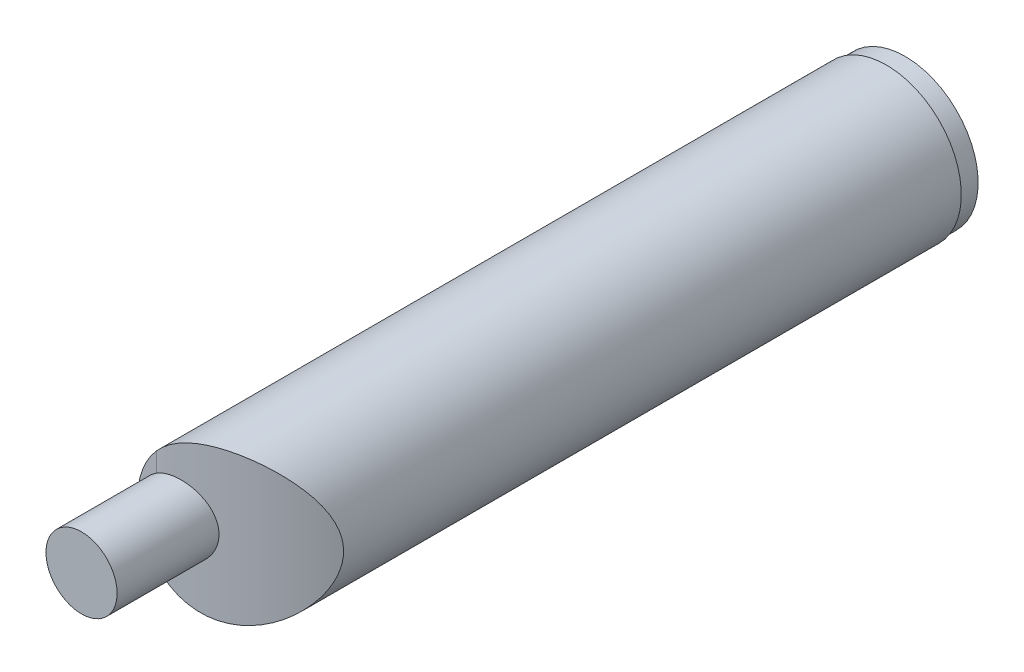
from build123d import *
from build123d.topology import SkipClean

# Parameters (mm, degrees)
SKETCH_1_R                  = 4
EXTRUDE_1_DEPTH             = 37
SKETCH_2_R                  = 4
SKETCH_2_R_2                = 3.9
SKETCH_2_R_3                = 0.5
CUT_EXTRUDE_1_DEPTH         = 1
CUT_EXTRUDE_2_DEPTH         = 38.429934544
CUT_EXTRUDE_2_DEPTH_BACK    = 38.429934544
EXTRUDE_2_REACH             = 39.43
SKETCH_4_R                  = 1.9
EXTRUDE_2_DIRECTION_2_DEPTH = 5


with BuildPart() as part:
    # 草图1 → 凸台-拉伸1 (new body)
    with BuildSketch(Plane.XY):
        Circle(SKETCH_1_R)
    extrude(amount=EXTRUDE_1_DEPTH)

    # 草图2 → 切除-拉伸1 (cut)
    # profile 1 of 2: a face of its own
    with BuildSketch(Plane(origin=(0, 0, 0), x_dir=(-1, 0, 0), z_dir=(0, 0, -1))):
        Circle(SKETCH_2_R)
        Circle(SKETCH_2_R_2, mode=Mode.SUBTRACT)
    # profile 2 of 2: a face of its own
    with BuildSketch(Plane(origin=(0, 0, 0), x_dir=(-1, 0, 0), z_dir=(0, 0, -1))):
        Circle(SKETCH_2_R_3)
    extrude(amount=-CUT_EXTRUDE_1_DEPTH, mode=Mode.SUBTRACT)

    # 草图3 → 切除-拉伸2 (cut, two sides: drawn at the far end of the back side and taken through both)
    with BuildSketch(Plane(origin=(0, 0, 0), x_dir=(1, 0, 0), z_dir=(0, 1, 0)).offset(-CUT_EXTRUDE_2_DEPTH_BACK)):
        with BuildLine():
            Line((-3, -37), (4, -37))
            Line((4, -37), (4, -34))
            ThreePointArc((4, -34), (0.807886553, -36.218401957), (-3, -37))
        make_face()
    extrude(amount=CUT_EXTRUDE_2_DEPTH + CUT_EXTRUDE_2_DEPTH_BACK, mode=Mode.SUBTRACT)

    # 草图4 → 凸台-拉伸2 (add, up to next)
    with BuildSketch(Plane.XY.offset(37), mode=Mode.PRIVATE) as extrude_2_sk1:
        with Locations((-2, 0)):
            Circle(SKETCH_4_R)
    extrude_2_tool1 = extrude(extrude_2_sk1.sketch, amount=-EXTRUDE_2_REACH, mode=Mode.PRIVATE) - part.part
    add(extrude_2_tool1.solids().sort_by_distance((-2, 0, 37))[0])

    # 草图4 → 凸台-拉伸2 direction 2 (add)
    with SkipClean():  # the faces are left unmerged after this step: merging them gives an invalid solid
        with BuildSketch(Plane.XY.offset(37)):
            with Locations((-2, 0)):
                Circle(SKETCH_4_R)
        extrude(amount=EXTRUDE_2_DIRECTION_2_DEPTH)
    add(part.part.scale(1), mode=Mode.REPLACE)  # the faces are merged on a copy


solid = part.part
